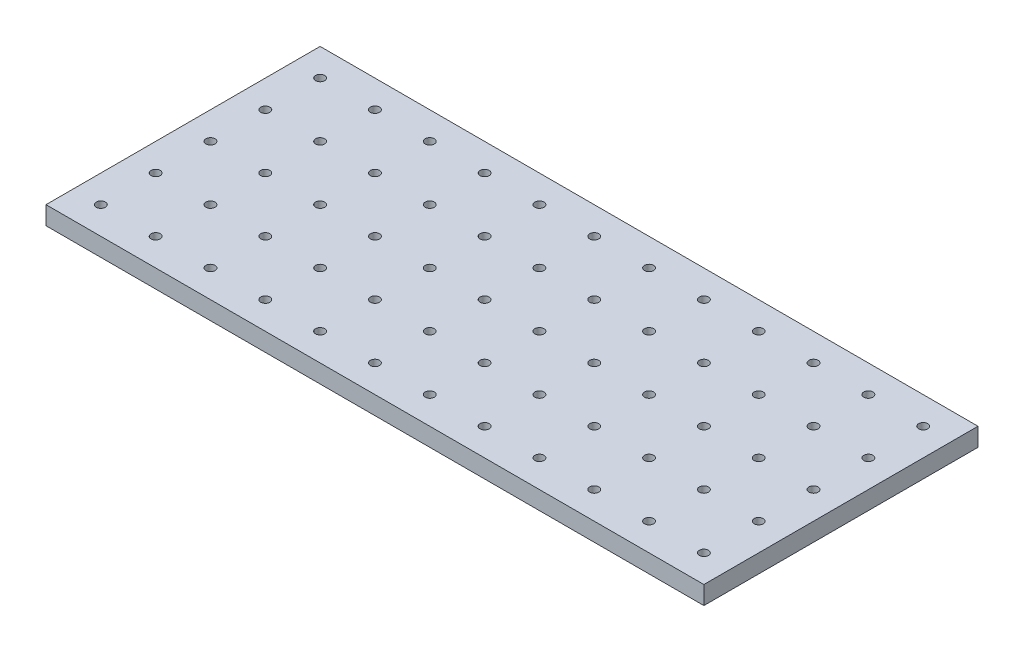
from build123d import *

# Parameters (mm, degrees)
SKETCH2_W           = 3600
SKETCH2_H           = 1500
BOSS_EXTRUDE1_DEPTH = 100
SKETCH3_R           = 25
CUT_EXTRUDE1_DEPTH  = 100


with BuildPart() as part:
    # Sketch2 → Boss-Extrude1 (new body)
    with BuildSketch(Plane(origin=(0, 0, 0), x_dir=(1, 0, 0), z_dir=(0, 1, 0))):
        Rectangle(SKETCH2_W, SKETCH2_H)
    extrude(amount=BOSS_EXTRUDE1_DEPTH)

    # Sketch3 → Cut-Extrude1 (cut)
    with BuildSketch(Plane(origin=(0, 100, 0), x_dir=(1, 0, 0), z_dir=(0, 1, 0))):
        with Locations(Location((-1650, 600, 0), (0, 0, 270))):
            Circle(SKETCH3_R)
        with Locations(Location((-1350, 600, 0), (0, 0, 270))):
            Circle(SKETCH3_R)
        with Locations(Location((-1050, 600, 0), (0, 0, 270))):
            Circle(SKETCH3_R)
        with Locations(Location((-750, 600, 0), (0, 0, 270))):
            Circle(SKETCH3_R)
        with Locations(Location((-450, 600, 0), (0, 0, 270))):
            Circle(SKETCH3_R)
        with Locations(Location((-150, 600, 0), (0, 0, 270))):
            Circle(SKETCH3_R)
        with Locations(Location((150, 600, 0), (0, 0, 270))):
            Circle(SKETCH3_R)
        with Locations(Location((450, 600, 0), (0, 0, 270))):
            Circle(SKETCH3_R)
        with Locations(Location((750, 600, 0), (0, 0, 270))):
            Circle(SKETCH3_R)
        with Locations(Location((1050, 600, 0), (0, 0, 270))):
            Circle(SKETCH3_R)
        with Locations(Location((1350, 600, 0), (0, 0, 270))):
            Circle(SKETCH3_R)
        with Locations(Location((1650, 600, 0), (0, 0, 270))):
            Circle(SKETCH3_R)
        with Locations(Location((-1350, 300, 0), (0, 0, 270))):
            Circle(SKETCH3_R)
        with Locations(Location((-1050, 300, 0), (0, 0, 270))):
            Circle(SKETCH3_R)
        with Locations(Location((-750, 300, 0), (0, 0, 270))):
            Circle(SKETCH3_R)
        with Locations(Location((-450, 300, 0), (0, 0, 270))):
            Circle(SKETCH3_R)
        with Locations(Location((-150, 300, 0), (0, 0, 270))):
            Circle(SKETCH3_R)
        with Locations(Location((150, 300, 0), (0, 0, 270))):
            Circle(SKETCH3_R)
        with Locations(Location((450, 300, 0), (0, 0, 270))):
            Circle(SKETCH3_R)
        with Locations(Location((750, 300, 0), (0, 0, 270))):
            Circle(SKETCH3_R)
        with Locations(Location((1050, 300, 0), (0, 0, 270))):
            Circle(SKETCH3_R)
        with Locations(Location((1350, 300, 0), (0, 0, 270))):
            Circle(SKETCH3_R)
        with Locations(Location((1650, 300, 0), (0, 0, 270))):
            Circle(SKETCH3_R)
        with Locations(Location((-1350, 0, 0), (0, 0, 270))):
            Circle(SKETCH3_R)
        with Locations(Location((-1050, 0, 0), (0, 0, 270))):
            Circle(SKETCH3_R)
        with Locations(Location((-750, 0, 0), (0, 0, 270))):
            Circle(SKETCH3_R)
        with Locations(Location((-450, 0, 0), (0, 0, 270))):
            Circle(SKETCH3_R)
        with Locations(Location((-150, 0, 0), (0, 0, 270))):
            Circle(SKETCH3_R)
        with Locations(Location((150, 0, 0), (0, 0, 270))):
            Circle(SKETCH3_R)
        with Locations(Location((450, 0, 0), (0, 0, 270))):
            Circle(SKETCH3_R)
        with Locations(Location((750, 0, 0), (0, 0, 270))):
            Circle(SKETCH3_R)
        with Locations(Location((1050, 0, 0), (0, 0, 270))):
            Circle(SKETCH3_R)
        with Locations(Location((1350, 0, 0), (0, 0, 270))):
            Circle(SKETCH3_R)
        with Locations(Location((1650, 0, 0), (0, 0, 270))):
            Circle(SKETCH3_R)
        with Locations(Location((-1350, -300, 0), (0, 0, 270))):
            Circle(SKETCH3_R)
        with Locations(Location((-1050, -300, 0), (0, 0, 270))):
            Circle(SKETCH3_R)
        with Locations(Location((-750, -300, 0), (0, 0, 270))):
            Circle(SKETCH3_R)
        with Locations(Location((-450, -300, 0), (0, 0, 270))):
            Circle(SKETCH3_R)
        with Locations(Location((-150, -300, 0), (0, 0, 270))):
            Circle(SKETCH3_R)
        with Locations(Location((150, -300, 0), (0, 0, 270))):
            Circle(SKETCH3_R)
        with Locations(Location((450, -300, 0), (0, 0, 270))):
            Circle(SKETCH3_R)
        with Locations(Location((750, -300, 0), (0, 0, 270))):
            Circle(SKETCH3_R)
        with Locations(Location((1050, -300, 0), (0, 0, 270))):
            Circle(SKETCH3_R)
        with Locations(Location((1350, -300, 0), (0, 0, 270))):
            Circle(SKETCH3_R)
        with Locations(Location((1650, -300, 0), (0, 0, 270))):
            Circle(SKETCH3_R)
        with Locations(Location((-1350, -600, 0), (0, 0, 270))):
            Circle(SKETCH3_R)
        with Locations(Location((-1050, -600, 0), (0, 0, 270))):
            Circle(SKETCH3_R)
        with Locations(Location((-750, -600, 0), (0, 0, 270))):
            Circle(SKETCH3_R)
        with Locations(Location((-450, -600, 0), (0, 0, 270))):
            Circle(SKETCH3_R)
        with Locations(Location((-150, -600, 0), (0, 0, 270))):
            Circle(SKETCH3_R)
        with Locations(Location((150, -600, 0), (0, 0, 270))):
            Circle(SKETCH3_R)
        with Locations(Location((450, -600, 0), (0, 0, 270))):
            Circle(SKETCH3_R)
        with Locations(Location((750, -600, 0), (0, 0, 270))):
            Circle(SKETCH3_R)
        with Locations(Location((1050, -600, 0), (0, 0, 270))):
            Circle(SKETCH3_R)
        with Locations(Location((1350, -600, 0), (0, 0, 270))):
            Circle(SKETCH3_R)
        with Locations(Location((1650, -600, 0), (0, 0, 270))):
            Circle(SKETCH3_R)
        with Locations(Location((-1650, 300, 0), (0, 0, 270))):
            Circle(SKETCH3_R)
        with Locations(Location((-1650, 0, 0), (0, 0, 270))):
            Circle(SKETCH3_R)
        with Locations(Location((-1650, -300, 0), (0, 0, 270))):
            Circle(SKETCH3_R)
        with Locations(Location((-1650, -600, 0), (0, 0, 270))):
            Circle(SKETCH3_R)
    extrude(amount=-CUT_EXTRUDE1_DEPTH, mode=Mode.SUBTRACT)


solid = part.part
